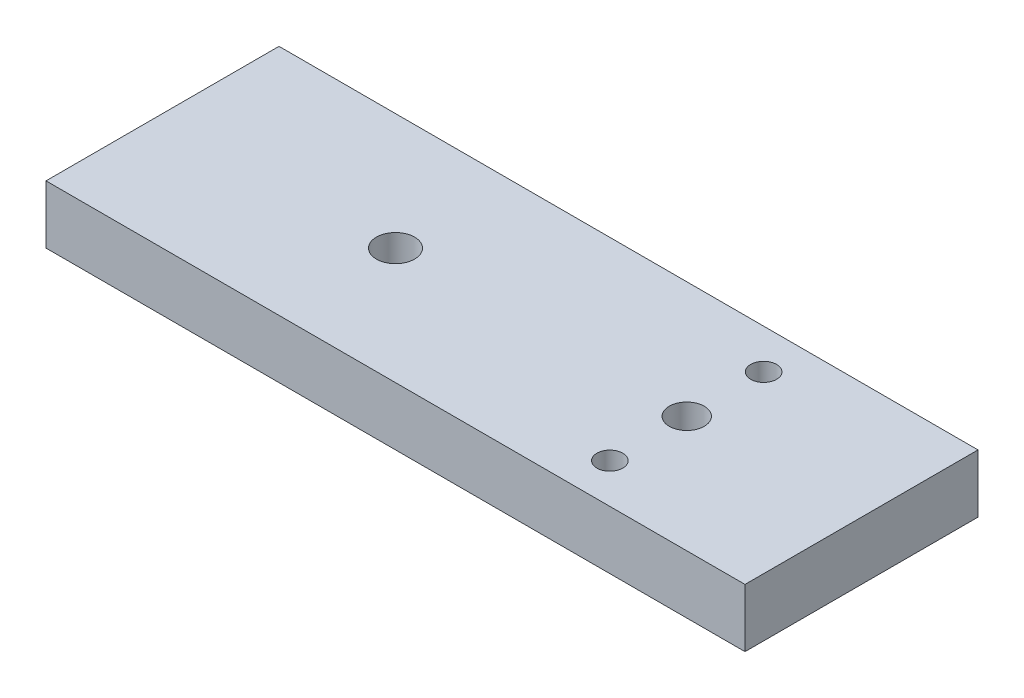
from build123d import *

# Parameters (mm, degrees)
SKETCH2_W           = 76.2
SKETCH2_H           = 25.4
SKETCH2_R           = 1.41224
SKETCH2_R_2         = 1.905
BOSS_EXTRUDE1_DEPTH = 6.35
SKETCH3_R           = 2.0828
CUT_EXTRUDE1_DEPTH  = 6.35


with BuildPart() as part:
    # Sketch2 → Boss-Extrude1 (new body)
    with BuildSketch(Plane(origin=(0, 0, 0), x_dir=(1, 0, 0), z_dir=(0, 1, 0))):
        with Locations((38.1, 12.7)):
            Rectangle(SKETCH2_W, SKETCH2_H)
        with Locations(Location((57.15, 21.082, 0), (0, 0, 270))):
            Circle(SKETCH2_R, mode=Mode.SUBTRACT)
        with Locations(Location((57.15, 4.318, 0), (0, 0, 270))):
            Circle(SKETCH2_R, mode=Mode.SUBTRACT)
        with Locations(Location((57.15, 12.7, 0), (0, 0, 270))):
            Circle(SKETCH2_R_2, mode=Mode.SUBTRACT)
    extrude(amount=BOSS_EXTRUDE1_DEPTH)

    # Sketch3 → Cut-Extrude1 (cut)
    with BuildSketch(Plane(origin=(0, 6.35, 0), x_dir=(1, 0, 0), z_dir=(0, 1, 0))):
        with Locations(Location((25.4, 12.7, 0), (0, 0, 270))):
            Circle(SKETCH3_R)
    extrude(amount=-CUT_EXTRUDE1_DEPTH, mode=Mode.SUBTRACT)


solid = part.part
